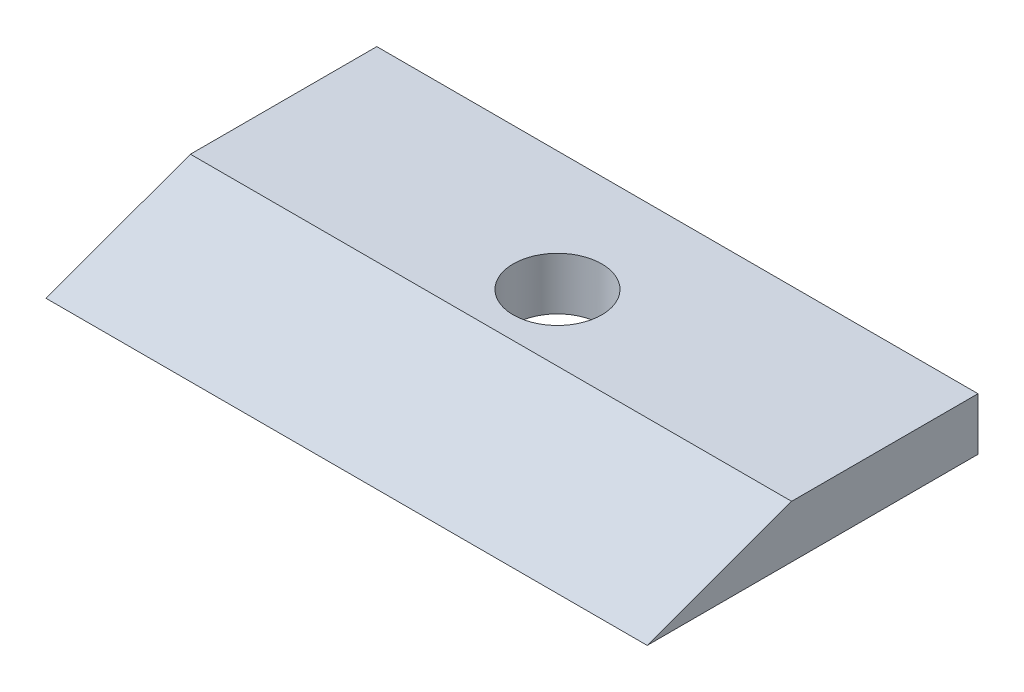
from build123d import *

# Parameters (mm, degrees)
BOSS_EXTRUDE1_DEPTH = 36.35
SKETCH2_R           = 2.675
CUT_EXTRUDE1_DEPTH  = 15


with BuildPart() as part:
    # Sketch1 → Boss-Extrude1 (new body)
    with BuildSketch(Plane(origin=(0, 0, 0), x_dir=(0, 0, -1), z_dir=(1, 0, 0))):
        Polygon((0, 0), (8.730186696, 3.18), (20, 3.18), (20, 0.005), align=None)
    extrude(amount=BOSS_EXTRUDE1_DEPTH)

    # Sketch2 → Cut-Extrude1 (cut)
    with BuildSketch(Plane(origin=(0, 3.18, 0), x_dir=(1, 0, 0), z_dir=(0, 1, 0))):
        with Locations(Location((18.175, 12.75, 0), (0, 0, 270))):
            Circle(SKETCH2_R)
    extrude(amount=-CUT_EXTRUDE1_DEPTH, mode=Mode.SUBTRACT)


solid = part.part
